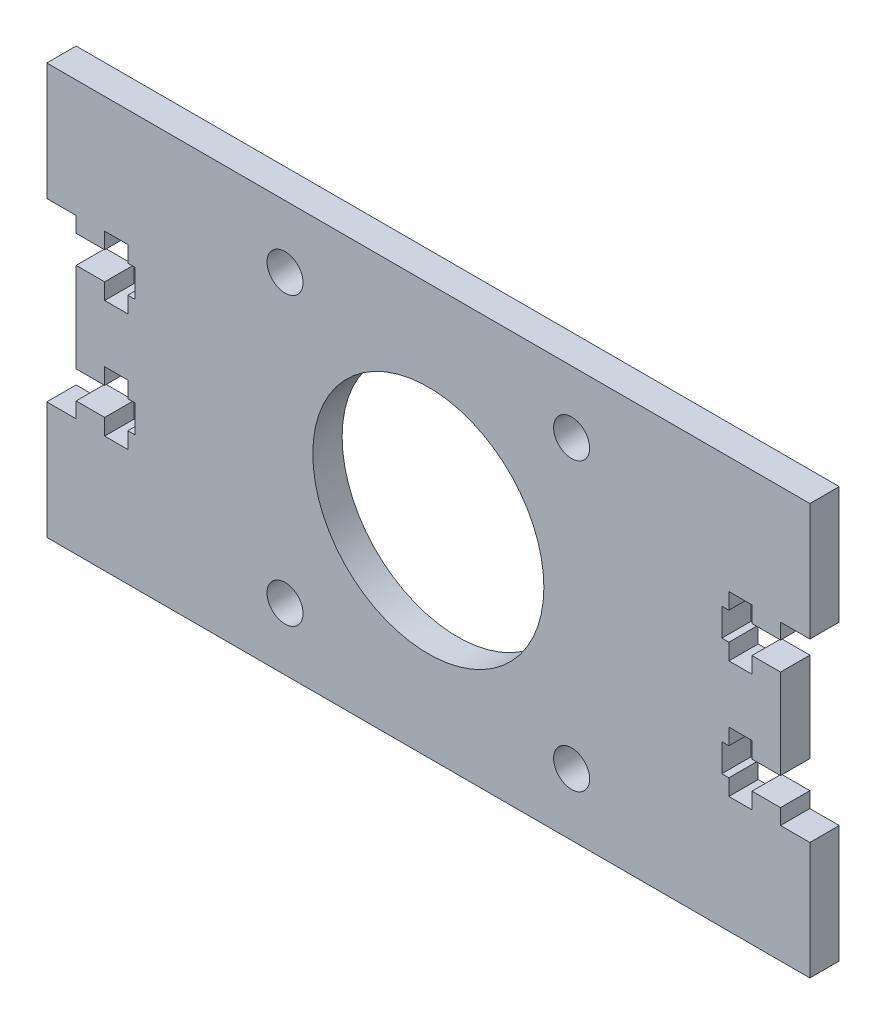
from build123d import *

# Parameters (mm, degrees)
SKETCH2_R           = 1.95
SKETCH2_R_2         = 12.5
BOSS_EXTRUDE1_DEPTH = 3.175


with BuildPart() as part:
    # Sketch2 → Boss-Extrude1 (new body)
    with BuildSketch(Plane.XY):
        Polygon((-3.175, 0), (79.375, 0), (79.375, 12.7), (76.2, 12.7), (76.2, 14.375), (73.112, 14.375), (73.112, 12.625), (70.612, 12.625), (70.612, 14.375), (69.85, 14.375), (69.85, 17.375), (70.612, 17.375), (70.612, 19.125), (73.112, 19.125), (73.112, 17.375), (76.2, 17.375), (76.2, 27.075), (73.112, 27.075), (73.112, 25.325), (70.612, 25.325), (70.612, 27.075), (69.85, 27.075), (69.85, 30.075), (70.612, 30.075), (70.612, 31.825), (73.112, 31.825), (73.112, 30.075), (76.2, 30.075), (76.2, 31.75), (79.375, 31.75), (79.375, 44.45), (-3.175, 44.45), (-3.175, 31.75), (0, 31.75), (0, 30.075), (3.088, 30.075), (3.088, 31.825), (5.588, 31.825), (5.588, 30.075), (6.35, 30.075), (6.35, 27.075), (5.588, 27.075), (5.588, 25.325), (3.088, 25.325), (3.088, 27.075), (0, 27.075), (0, 17.375), (3.088, 17.375), (3.088, 19.125), (5.588, 19.125), (5.588, 17.375), (6.35, 17.375), (6.35, 14.375), (5.588, 14.375), (5.588, 12.625), (3.088, 12.625), (3.088, 14.375), (0, 14.375), (0, 12.7), (-3.175, 12.7), align=None)
        with Locations((22.6, 6.725)):
            Circle(SKETCH2_R, mode=Mode.SUBTRACT)
        with Locations((53.6, 6.725)):
            Circle(SKETCH2_R, mode=Mode.SUBTRACT)
        with Locations((38.1, 22.225)):
            Circle(SKETCH2_R_2, mode=Mode.SUBTRACT)
        with Locations((22.6, 37.725)):
            Circle(SKETCH2_R, mode=Mode.SUBTRACT)
        with Locations((53.6, 37.725)):
            Circle(SKETCH2_R, mode=Mode.SUBTRACT)
    extrude(amount=BOSS_EXTRUDE1_DEPTH)


solid = part.part
